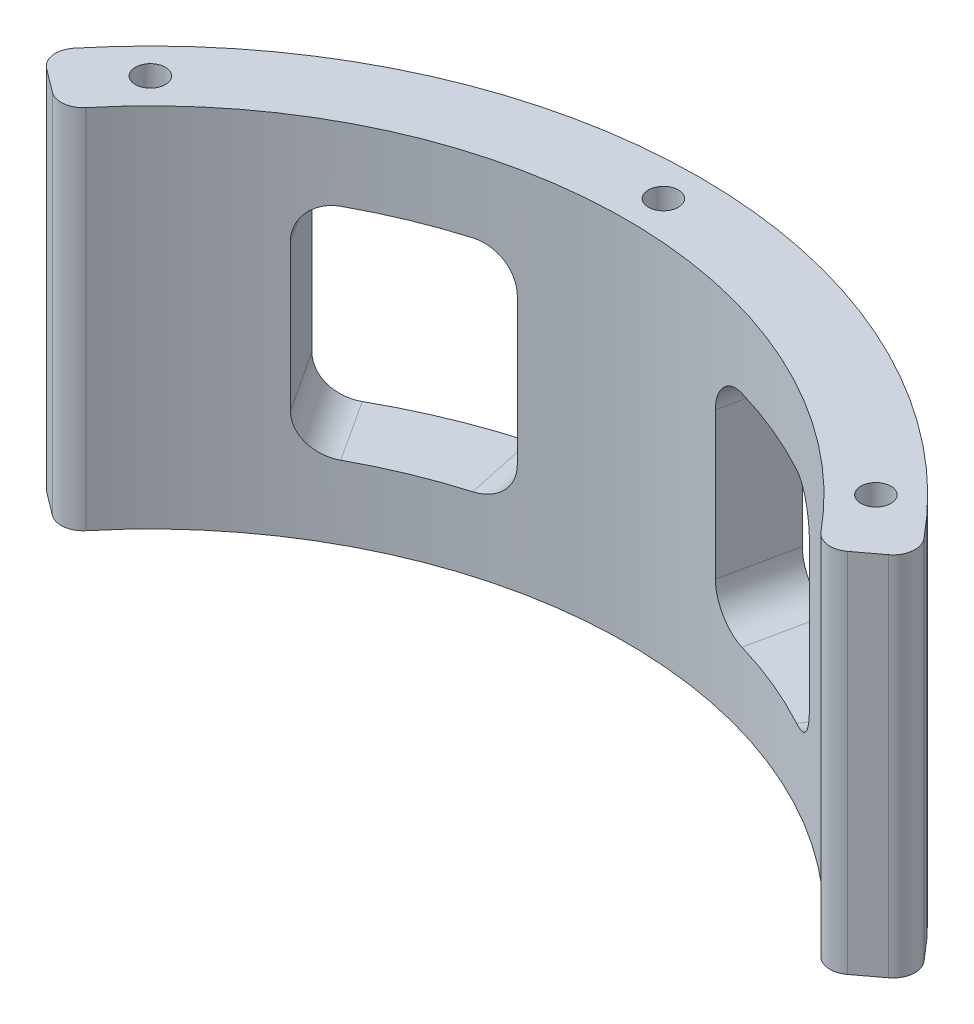
from build123d import *

# Parameters (mm, degrees)
SKETCH_1_R          = 2.05
EXTRUDE_1_DEPTH     = 25
FILLET_2_R          = 3
CUT_EXTRUDE_1_DEPTH = 15
FILLET_3_R          = 5


with BuildPart() as part:
    # 草图1 → 凸台-拉伸1 (new, symmetric)
    with BuildSketch(Plane(origin=(0, 0, 0), x_dir=(1, 0, 0), z_dir=(0, 1, 0))):
        with BuildLine():
            Line((-59.897663254, 45.136126736), (-51.911308153, 39.117976505))
            ThreePointArc((-51.911308153, 39.117976505), (0, 65), (51.911308153, 39.117976505))
            Line((51.911308153, 39.117976505), (59.897663254, 45.136126736))
            ThreePointArc((59.897663254, 45.136126736), (0, 75), (-59.897663254, 45.136126736))
        make_face()
        with Locations(Location((-49.497474683, 49.497474683, 0), (0, 0, 270))):
            Circle(SKETCH_1_R, mode=Mode.SUBTRACT)
        with Locations(Location((0, 70, 0), (0, 0, 270))):
            Circle(SKETCH_1_R, mode=Mode.SUBTRACT)
        with Locations(Location((49.497474683, 49.497474683, 0), (0, 0, 270))):
            Circle(SKETCH_1_R, mode=Mode.SUBTRACT)
    extrude(amount=EXTRUDE_1_DEPTH, both=True)

    # 圆角2
    fillet_2_edges = [part.edges().sort_by_distance(p)[0] for p in [
        (-51.911308153, 0, -39.117976505),
        (-59.897663254, 0, -45.136126736),
        (59.897663254, 0, -45.136126736),
        (51.911308153, 0, -39.117976505),
    ]]
    fillet(fillet_2_edges, radius=FILLET_2_R)

    # 草图2 → 切除-拉伸1 (cut, symmetric)
    with BuildSketch(Plane(origin=(0, 0, 0), x_dir=(1, 0, 0), z_dir=(0, 1, 0))):
        with BuildLine():
            Line((-40.847927626, 62.900292596), (-35.401537276, 54.513586916))
            ThreePointArc((-35.401537276, 54.513586916), (-24.874423104, 60.052169613), (-13.514259903, 63.579594048))
            Line((-13.514259903, 63.579594048), (-15.593376811, 73.361070055))
            ThreePointArc((-15.593376811, 73.361070055), (-28.701257427, 69.290964938), (-40.847927626, 62.900292596))
        make_face()
        with BuildLine():
            ThreePointArc((13.514259903, 63.579594048), (24.874423104, 60.052169613), (35.401537276, 54.513586916))
            Line((35.401537276, 54.513586916), (40.847927626, 62.900292596))
            ThreePointArc((40.847927626, 62.900292596), (28.701257427, 69.290964938), (15.593376811, 73.361070055))
            Line((15.593376811, 73.361070055), (13.514259903, 63.579594048))
        make_face()
    extrude(amount=CUT_EXTRUDE_1_DEPTH, both=True, mode=Mode.SUBTRACT)

    # 圆角3
    fillet_3_edges = [part.edges().sort_by_distance(p)[0] for p in [
        (-38.124732451, 15, -58.706939756),
        (-14.553818357, -15, -68.470332051),
        (-38.124732451, -15, -58.706939756),
        (-14.553818357, 15, -68.470332051),
        (14.553818357, 15, -68.470332051),
        (38.124732451, -15, -58.706939756),
        (14.553818357, -15, -68.470332051),
        (38.124732451, 15, -58.706939756),
    ]]
    fillet(fillet_3_edges, radius=FILLET_3_R)


solid = part.part
